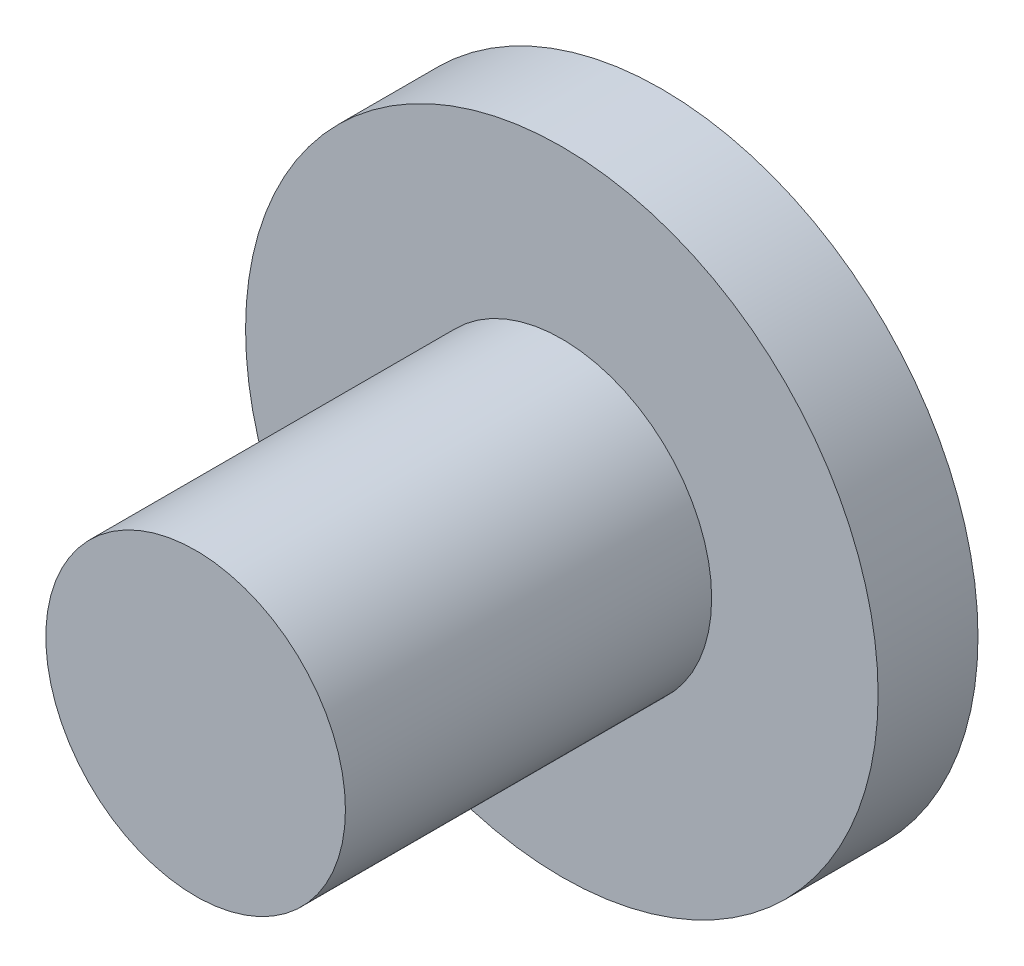
from build123d import *

# Parameters (mm, degrees)
SKETCH_1_R      = 4.75
EXTRUDE_1_DEPTH = 1.5
SKETCH_2_R      = 2.25
EXTRUDE_2_DEPTH = 5.5


with BuildPart() as part:
    # 草图1 → 凸台-拉伸1 (new body)
    with BuildSketch(Plane.XY):
        Circle(SKETCH_1_R)
    extrude(amount=EXTRUDE_1_DEPTH)

    # 草图2 → 凸台-拉伸2 (add)
    with BuildSketch(Plane.XY.offset(1.5)):
        Circle(SKETCH_2_R)
    extrude(amount=EXTRUDE_2_DEPTH)


solid = part.part
